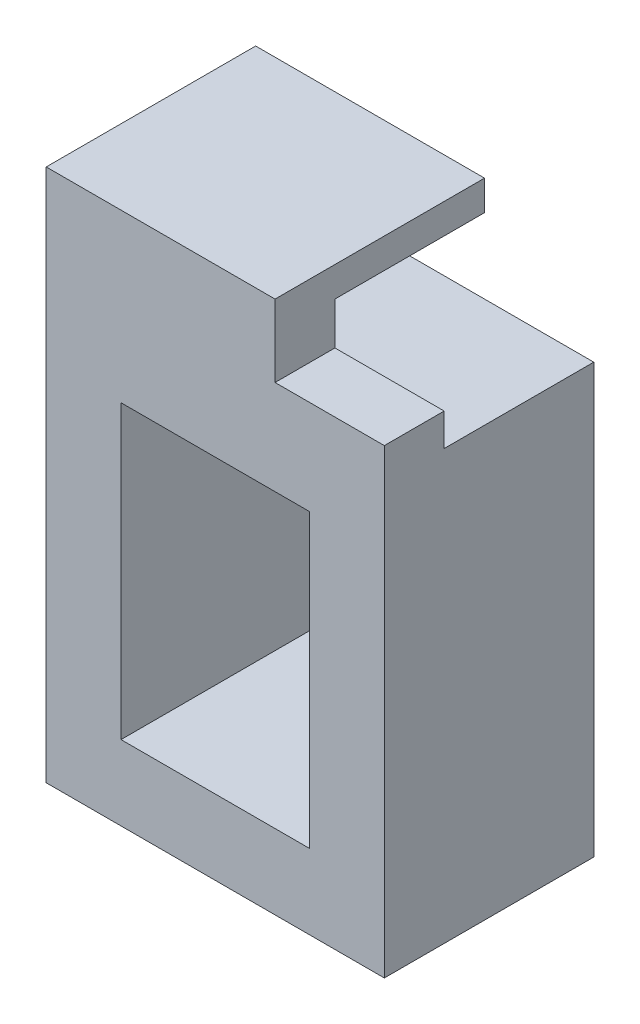
from build123d import *

# Parameters (mm, degrees)
SKETCH1_W           = 22.6
SKETCH1_H           = 28.65
SKETCH1_W_2         = 12.6
SKETCH1_H_2         = 19.5
BOSS_EXTRUDE1_DEPTH = 14
SKETCH3_W           = 22.6
SKETCH3_H           = 7
BOSS_EXTRUDE2_DEPTH = 4
SKETCH4_W           = 22.6
SKETCH4_H           = 2
BOSS_EXTRUDE3_DEPTH = 10
SKETCH5_W           = 25.687080714
SKETCH5_H           = 15.752193048
CUT_EXTRUDE1_DEPTH  = 28.577164466


with BuildPart() as part:
    # Sketch1 → Boss-Extrude1 (new body)
    with BuildSketch(Plane.XY):
        with Locations((0, -0.425)):
            Rectangle(SKETCH1_W, SKETCH1_H)
        Rectangle(SKETCH1_W_2, SKETCH1_H_2, mode=Mode.SUBTRACT)
    extrude(amount=BOSS_EXTRUDE1_DEPTH)

    # Sketch3 → Boss-Extrude2 (add)
    with BuildSketch(Plane.XY.offset(10)):
        with Locations((0, 17.4)):
            Rectangle(SKETCH3_W, SKETCH3_H)
    extrude(amount=BOSS_EXTRUDE2_DEPTH)

    # Sketch4 → Boss-Extrude3 (add)
    with BuildSketch(Plane(origin=(0, 0, 10), x_dir=(-1, 0, 0), z_dir=(0, 0, -1))):
        with Locations((0, 19.9)):
            Rectangle(SKETCH4_W, SKETCH4_H)
    extrude(amount=BOSS_EXTRUDE3_DEPTH)

    # Sketch5 → Cut-Extrude1 (cut, through all)
    with BuildSketch(Plane.XY.offset(14)):
        with Locations((16.840510888, 23.946149684)):
            Rectangle(SKETCH5_W, SKETCH5_H)
    extrude(amount=-CUT_EXTRUDE1_DEPTH, mode=Mode.SUBTRACT)


solid = part.part
